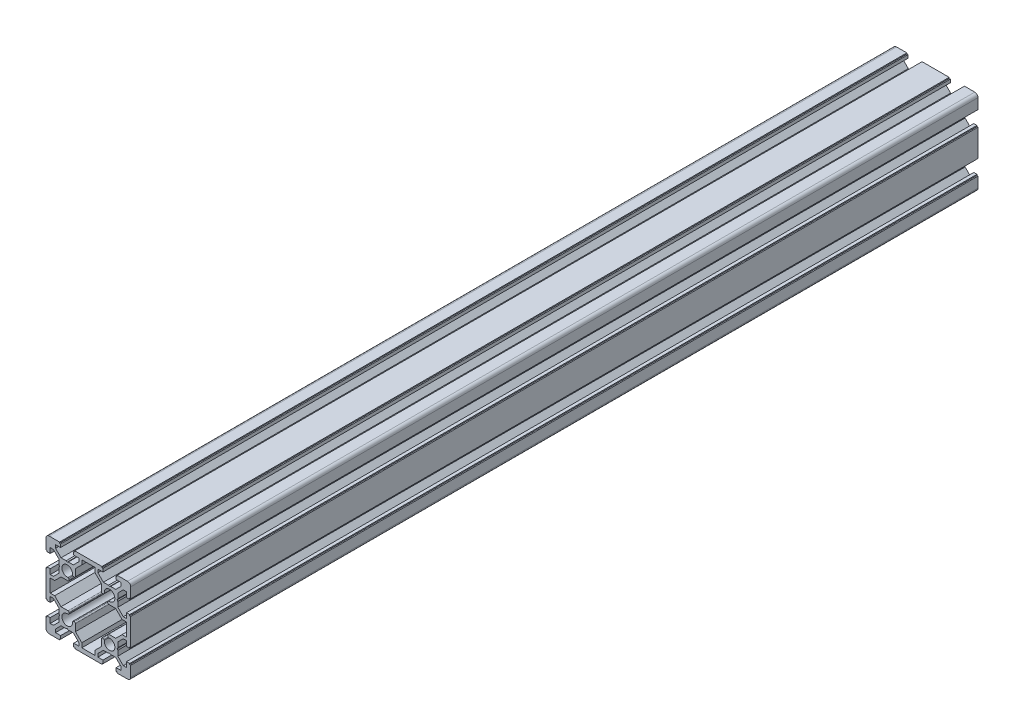
from build123d import *

# Parameters (mm, degrees)
EXTRUDE_1_DEPTH = 400


with BuildPart() as part:
    # 草图29 → 凸台-拉伸1 (new body)
    with BuildSketch(Plane.XY):
        with BuildLine():
            Line((0.519615242, -3.9), (2.910050506, -3.9))
            Line((2.910050506, -3.9), (5.5, -6.489949494))
            Line((5.5, -6.489949494), (5.5, -8))
            Line((5.5, -8), (3.1, -8))
            Line((3.1, -8), (3.1, -9.5))
            Line((3.1, -9.5), (3.6, -9.5))
            Line((3.6, -9.5), (3.6, -10))
            Line((3.6, -10), (16.4, -10))
            Line((16.4, -10), (16.4, -9.5))
            Line((16.4, -9.5), (16.9, -9.5))
            Line((16.9, -9.5), (16.9, -8))
            Line((16.9, -8), (14.5, -8))
            Line((14.5, -8), (14.5, -6.489949494))
            Line((14.5, -6.489949494), (17.089949494, -3.9))
            Line((17.089949494, -3.9), (19.480384758, -3.9))
            Line((19.480384758, -3.9), (20, -3.6))
            Line((20, -3.6), (20.519615242, -3.9))
            Line((20.519615242, -3.9), (22.910050506, -3.9))
            Line((22.910050506, -3.9), (25.5, -6.489949494))
            Line((25.5, -6.489949494), (25.5, -8))
            Line((25.5, -8), (23.1, -8))
            Line((23.1, -8), (23.1, -9.5))
            Line((23.1, -9.5), (23.6, -9.5))
            Line((23.6, -9.5), (23.6, -10))
            Line((23.6, -10), (28.5, -10))
            ThreePointArc((28.5, -10), (29.560660172, -9.560660172), (30, -8.5))
            Line((30, -8.5), (30, -3.6))
            Line((30, -3.6), (29.5, -3.6))
            Line((29.5, -3.6), (29.5, -3.1))
            Line((29.5, -3.1), (28, -3.1))
            Line((28, -3.1), (28, -5.5))
            Line((28, -5.5), (26.489949494, -5.5))
            Line((26.489949494, -5.5), (23.9, -2.910050506))
            Line((23.9, -2.910050506), (23.9, -0.519615242))
            Line((23.9, -0.519615242), (23.6, 0))
            Line((23.6, 0), (23.9, 0.519615242))
            Line((23.9, 0.519615242), (23.9, 2.910050506))
            Line((23.9, 2.910050506), (26.489949494, 5.5))
            Line((26.489949494, 5.5), (28, 5.5))
            Line((28, 5.5), (28, 3.1))
            Line((28, 3.1), (29.5, 3.1))
            Line((29.5, 3.1), (29.5, 3.6))
            Line((29.5, 3.6), (30, 3.6))
            Line((30, 3.6), (30, 16.4))
            Line((30, 16.4), (29.5, 16.4))
            Line((29.5, 16.4), (29.5, 16.9))
            Line((29.5, 16.9), (28, 16.9))
            Line((28, 16.9), (28, 14.5))
            Line((28, 14.5), (26.489949494, 14.5))
            Line((26.489949494, 14.5), (23.9, 17.089949494))
            Line((23.9, 17.089949494), (23.9, 19.480384758))
            Line((23.9, 19.480384758), (23.6, 20))
            Line((23.6, 20), (23.9, 20.519615242))
            Line((23.9, 20.519615242), (23.9, 22.910050506))
            Line((23.9, 22.910050506), (26.489949494, 25.5))
            Line((26.489949494, 25.5), (28, 25.5))
            Line((28, 25.5), (28, 23.1))
            Line((28, 23.1), (29.5, 23.1))
            Line((29.5, 23.1), (29.5, 23.6))
            Line((29.5, 23.6), (30, 23.6))
            Line((30, 23.6), (30, 28.5))
            ThreePointArc((30, 28.5), (29.560660172, 29.560660172), (28.5, 30))
            Line((28.5, 30), (23.6, 30))
            Line((23.6, 30), (23.6, 29.5))
            Line((23.6, 29.5), (23.1, 29.5))
            Line((23.1, 29.5), (23.1, 28))
            Line((23.1, 28), (25.5, 28))
            Line((25.5, 28), (25.5, 26.489949494))
            Line((25.5, 26.489949494), (22.910050506, 23.9))
            Line((22.910050506, 23.9), (20.519615242, 23.9))
            Line((20.519615242, 23.9), (20, 23.6))
            Line((20, 23.6), (19.480384758, 23.9))
            Line((19.480384758, 23.9), (17.089949494, 23.9))
            Line((17.089949494, 23.9), (14.5, 26.489949494))
            Line((14.5, 26.489949494), (14.5, 28))
            Line((14.5, 28), (16.9, 28))
            Line((16.9, 28), (16.9, 29.5))
            Line((16.9, 29.5), (16.4, 29.5))
            Line((16.4, 29.5), (16.4, 30))
            Line((16.4, 30), (3.6, 30))
            Line((3.6, 30), (3.6, 29.5))
            Line((3.6, 29.5), (3.1, 29.5))
            Line((3.1, 29.5), (3.1, 28))
            Line((3.1, 28), (5.5, 28))
            Line((5.5, 28), (5.5, 26.489949494))
            Line((5.5, 26.489949494), (2.910050506, 23.9))
            Line((2.910050506, 23.9), (0.519615242, 23.9))
            Line((0.519615242, 23.9), (0, 23.6))
            Line((0, 23.6), (-0.519615242, 23.9))
            Line((-0.519615242, 23.9), (-2.910050506, 23.9))
            Line((-2.910050506, 23.9), (-5.5, 26.489949494))
            Line((-5.5, 26.489949494), (-5.5, 28))
            Line((-5.5, 28), (-3.1, 28))
            Line((-3.1, 28), (-3.1, 29.5))
            Line((-3.1, 29.5), (-3.6, 29.5))
            Line((-3.6, 29.5), (-3.6, 30))
            Line((-3.6, 30), (-8.5, 30))
            ThreePointArc((-8.5, 30), (-9.560660172, 29.560660172), (-10, 28.5))
            Line((-10, 28.5), (-10, 23.6))
            Line((-10, 23.6), (-9.5, 23.6))
            Line((-9.5, 23.6), (-9.5, 23.1))
            Line((-9.5, 23.1), (-8, 23.1))
            Line((-8, 23.1), (-8, 25.5))
            Line((-8, 25.5), (-6.489949494, 25.5))
            Line((-6.489949494, 25.5), (-3.9, 22.910050506))
            Line((-3.9, 22.910050506), (-3.9, 20.519615242))
            Line((-3.9, 20.519615242), (-3.6, 20))
            Line((-3.6, 20), (-3.9, 19.480384758))
            Line((-3.9, 19.480384758), (-3.9, 17.089949494))
            Line((-3.9, 17.089949494), (-6.489949494, 14.5))
            Line((-6.489949494, 14.5), (-8, 14.5))
            Line((-8, 14.5), (-8, 16.9))
            Line((-8, 16.9), (-9.5, 16.9))
            Line((-9.5, 16.9), (-9.5, 16.4))
            Line((-9.5, 16.4), (-10, 16.4))
            Line((-10, 16.4), (-10, 3.6))
            Line((-10, 3.6), (-9.5, 3.6))
            Line((-9.5, 3.6), (-9.5, 3.1))
            Line((-9.5, 3.1), (-8, 3.1))
            Line((-8, 3.1), (-8, 5.5))
            Line((-8, 5.5), (-6.489949494, 5.5))
            Line((-6.489949494, 5.5), (-3.9, 2.910050506))
            Line((-3.9, 2.910050506), (-3.9, 0.519615242))
            Line((-3.9, 0.519615242), (-3.6, 0))
            Line((-3.6, 0), (-3.9, -0.519615242))
            Line((-3.9, -0.519615242), (-3.9, -2.910050506))
            Line((-3.9, -2.910050506), (-6.489949494, -5.5))
            Line((-6.489949494, -5.5), (-8, -5.5))
            Line((-8, -5.5), (-8, -3.1))
            Line((-8, -3.1), (-9.5, -3.1))
            Line((-9.5, -3.1), (-9.5, -3.6))
            Line((-9.5, -3.6), (-10, -3.6))
            Line((-10, -3.6), (-10, -8.5))
            ThreePointArc((-10, -8.5), (-9.560660172, -9.560660172), (-8.5, -10))
            Line((-8.5, -10), (-3.6, -10))
            Line((-3.6, -10), (-3.6, -9.5))
            Line((-3.6, -9.5), (-3.1, -9.5))
            Line((-3.1, -9.5), (-3.1, -8))
            Line((-3.1, -8), (-5.5, -8))
            Line((-5.5, -8), (-5.5, -6.489949494))
            Line((-5.5, -6.489949494), (-2.910050506, -3.9))
            Line((-2.910050506, -3.9), (-0.519615242, -3.9))
            Line((-0.519615242, -3.9), (0, -3.6))
            Line((0, -3.6), (0.519615242, -3.9))
        make_face()
        with BuildLine():
            Line((28, 6.9), (25.910050506, 6.9))
            Line((25.910050506, 6.9), (22.910050506, 3.9))
            Line((22.910050506, 3.9), (19.606610836, 3.9))
            ThreePointArc((19.606610836, 3.9), (19.209934166, 3.704380715), (19.123647923, 3.270590477))
            Line((19.123647923, 3.270590477), (19.279478272, 2.689023696))
            ThreePointArc((19.279478272, 2.689023696), (19.405533701, 2.515283248), (19.615407161, 2.470240545))
            ThreePointArc((19.615407161, 2.470240545), (21.767766953, -1.767766953), (17.529759455, 0.384592839))
            ThreePointArc((17.529759455, 0.384592839), (17.484716752, 0.594466299), (17.310976304, 0.720521728))
            Line((17.310976304, 0.720521728), (16.729409523, 0.876352077))
            ThreePointArc((16.729409523, 0.876352077), (16.295619285, 0.790065834), (16.1, 0.393389164))
            Line((16.1, 0.393389164), (16.1, -2.910050506))
            Line((16.1, -2.910050506), (13.1, -5.910050506))
            Line((13.1, -5.910050506), (13.1, -8))
            Line((13.1, -8), (6.9, -8))
            Line((6.9, -8), (6.9, -5.910050506))
            Line((6.9, -5.910050506), (3.9, -2.910050506))
            Line((3.9, -2.910050506), (3.9, 0.393389164))
            ThreePointArc((3.9, 0.393389164), (3.704380715, 0.790065834), (3.270590477, 0.876352077))
            Line((3.270590477, 0.876352077), (2.689023696, 0.720521728))
            ThreePointArc((2.689023696, 0.720521728), (2.515283248, 0.594466299), (2.470240545, 0.384592839))
            ThreePointArc((2.470240545, 0.384592839), (-1.767766953, -1.767766953), (0.384592839, 2.470240545))
            ThreePointArc((0.384592839, 2.470240545), (0.594466299, 2.515283248), (0.720521728, 2.689023696))
            Line((0.720521728, 2.689023696), (0.876352077, 3.270590477))
            ThreePointArc((0.876352077, 3.270590477), (0.790065834, 3.704380715), (0.393389164, 3.9))
            Line((0.393389164, 3.9), (-2.910050506, 3.9))
            Line((-2.910050506, 3.9), (-5.910050506, 6.9))
            Line((-5.910050506, 6.9), (-8, 6.9))
            Line((-8, 6.9), (-8, 13.1))
            Line((-8, 13.1), (-5.910050506, 13.1))
            Line((-5.910050506, 13.1), (-2.910050506, 16.1))
            Line((-2.910050506, 16.1), (0.393389164, 16.1))
            ThreePointArc((0.393389164, 16.1), (0.790065834, 16.295619285), (0.876352077, 16.729409523))
            Line((0.876352077, 16.729409523), (0.720521728, 17.310976304))
            ThreePointArc((0.720521728, 17.310976304), (0.594466299, 17.484716752), (0.384592839, 17.529759455))
            ThreePointArc((0.384592839, 17.529759455), (-1.767766953, 21.767766953), (2.470240545, 19.615407161))
            ThreePointArc((2.470240545, 19.615407161), (2.515283248, 19.405533701), (2.689023696, 19.279478272))
            Line((2.689023696, 19.279478272), (3.270590477, 19.123647923))
            ThreePointArc((3.270590477, 19.123647923), (3.704380715, 19.209934166), (3.9, 19.606610836))
            Line((3.9, 19.606610836), (3.9, 22.910050506))
            Line((3.9, 22.910050506), (6.9, 25.910050506))
            Line((6.9, 25.910050506), (6.9, 28))
            Line((6.9, 28), (13.1, 28))
            Line((13.1, 28), (13.1, 25.910050506))
            Line((13.1, 25.910050506), (16.1, 22.910050506))
            Line((16.1, 22.910050506), (16.1, 19.606610836))
            ThreePointArc((16.1, 19.606610836), (16.295619285, 19.209934166), (16.729409523, 19.123647923))
            Line((16.729409523, 19.123647923), (17.310976304, 19.279478272))
            ThreePointArc((17.310976304, 19.279478272), (17.484716752, 19.405533701), (17.529759455, 19.615407161))
            ThreePointArc((17.529759455, 19.615407161), (21.767766953, 21.767766953), (19.615407161, 17.529759455))
            ThreePointArc((19.615407161, 17.529759455), (19.405533701, 17.484716752), (19.279478272, 17.310976304))
            Line((19.279478272, 17.310976304), (19.123647923, 16.729409523))
            ThreePointArc((19.123647923, 16.729409523), (19.209934166, 16.295619285), (19.606610836, 16.1))
            Line((19.606610836, 16.1), (22.910050506, 16.1))
            Line((22.910050506, 16.1), (25.910050506, 13.1))
            Line((25.910050506, 13.1), (28, 13.1))
            Line((28, 13.1), (28, 6.9))
        make_face(mode=Mode.SUBTRACT)
    extrude(amount=EXTRUDE_1_DEPTH)


solid = part.part
